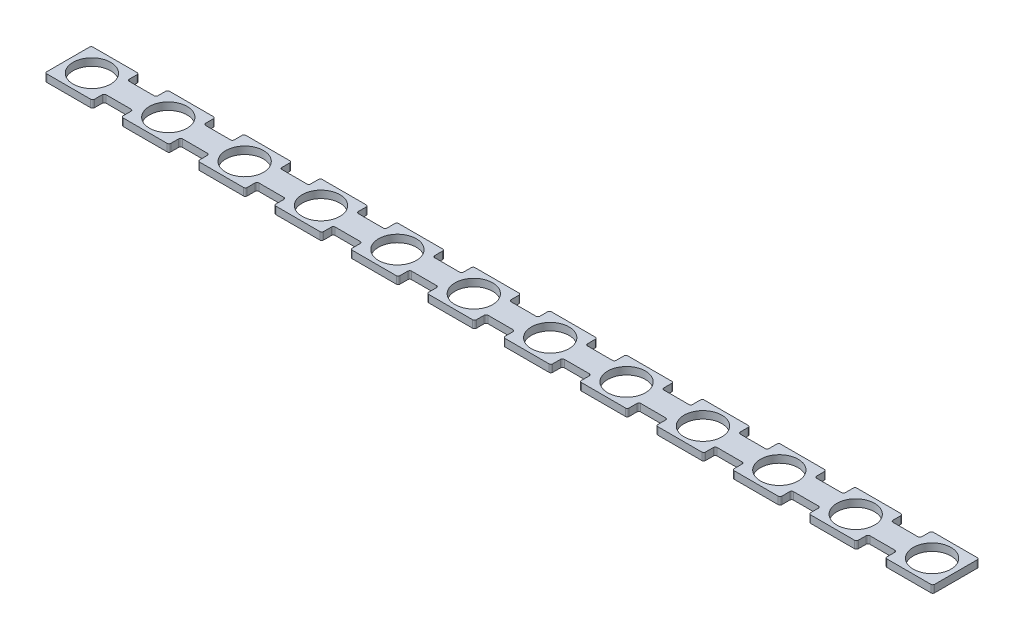
from build123d import *

# Parameters (mm, degrees)
BASE_DEPTH            = 0.4
NOTCH_DEPTH           = 49.021791928
HOLES_R               = 2.036544151
HOLE_DEPTH            = 49.021791928
HOLELP_COUNT          = 12
HOLELP_PITCH          = 8.25
NOTCHLP_COUNT         = 11
NOTCHLP_PITCH         = 8.25
NOTCHLP_COPY_1_DEPTH  = 49.021791928
NOTCHLP_COPY_2_DEPTH  = 49.021791928
NOTCHLP_COPY_3_DEPTH  = 49.021791928
NOTCHLP_COPY_4_DEPTH  = 49.021791928
NOTCHLP_COPY_5_DEPTH  = 49.021791928
NOTCHLP_COPY_6_DEPTH  = 49.021791928
NOTCHLP_COPY_7_DEPTH  = 49.021791928
NOTCHLP_COPY_8_DEPTH  = 49.021791928
NOTCHLP_COPY_9_DEPTH  = 49.021791928
NOTCHLP_COPY_10_DEPTH = 49.021791928


with BuildPart() as part:
    # BaseS → Base (new, symmetric)
    with BuildSketch(Plane(origin=(0, 0, 0), x_dir=(1, 0, 0), z_dir=(0, 1, 0))):
        with BuildLine():
            Line((-47.75, 2.5), (47.75, 2.5))
            ThreePointArc((47.75, 2.5), (47.891421356, 2.441421356), (47.95, 2.3))
            Line((47.95, 2.3), (47.95, -2.3))
            ThreePointArc((47.95, -2.3), (47.891421356, -2.441421356), (47.75, -2.5))
            Line((47.75, -2.5), (-47.75, -2.5))
            ThreePointArc((-47.75, -2.5), (-47.891421356, -2.441421356), (-47.95, -2.3))
            Line((-47.95, -2.3), (-47.95, 2.3))
            ThreePointArc((-47.95, 2.3), (-47.891421356, 2.441421356), (-47.75, 2.5))
        make_face()
    extrude(amount=BASE_DEPTH, both=True)

    # NotchS → Notch (cut, through all)
    with BuildSketch(Plane(origin=(0, 0.4, 0), x_dir=(1, 0, 0), z_dir=(0, 1, 0))):
        with BuildLine():
            Line((-42.6, 1.25), (-39.9, 1.25))
            ThreePointArc((-39.9, 1.25), (-39.758578644, 1.308578644), (-39.7, 1.45))
            Line((-39.7, 1.45), (-39.7, 2.299815366))
            ThreePointArc((-39.7, 2.299815366), (-39.641367278, 2.441367278), (-39.499815366, 2.5))
            Line((-39.499815366, 2.5), (-39.7, 2.5))
            Line((-39.7, 2.5), (-42.8, 2.5))
            Line((-42.8, 2.5), (-43.000184634, 2.5))
            ThreePointArc((-43.000184634, 2.5), (-42.858632722, 2.441367278), (-42.8, 2.299815366))
            Line((-42.8, 2.299815366), (-42.8, 1.45))
            ThreePointArc((-42.8, 1.45), (-42.741421356, 1.308578644), (-42.6, 1.25))
        make_face()
    notch = extrude(amount=-NOTCH_DEPTH, mode=Mode.SUBTRACT)

    # NotchVM: Notch across plane
    add(notch.mirror(Plane.XY), mode=Mode.SUBTRACT)

    # HoleS → Hole (cut, through all)
    with BuildSketch(Plane(origin=(0, 0.4, 0), x_dir=(1, 0, 0), z_dir=(0, 1, 0))):
        with Locations(Location((-45.375, 0, 0), (0, 0, 270))):
            Circle(HOLES_R)
    hole = extrude(amount=-HOLE_DEPTH, mode=Mode.SUBTRACT)

    # HoleLP: Hole ×12
    with Locations(*[(i * HOLELP_PITCH, 0, 0) for i in range(1, HOLELP_COUNT)]):
        add(hole, mode=Mode.SUBTRACT)

    # NotchLP: Notch ×11
    with Locations(*[(i * NOTCHLP_PITCH, 0, 0) for i in range(1, NOTCHLP_COUNT)]):
        add(notch, mode=Mode.SUBTRACT)

    # NotchLP copy 1 sketch → NotchLP copy 1 (cut, through all)
    with BuildSketch(Plane(origin=(8.25, 0.4, 0), x_dir=(1, 0, 0), z_dir=(0, 1, 0))):
        with BuildLine():
            Line((-42.6, -1.25), (-39.9, -1.25))
            ThreePointArc((-39.9, -1.25), (-39.758578644, -1.308578644), (-39.7, -1.45))
            Line((-39.7, -1.45), (-39.7, -2.299815366))
            ThreePointArc((-39.7, -2.299815366), (-39.641367278, -2.441367278), (-39.499815366, -2.5))
            Line((-39.499815366, -2.5), (-39.7, -2.5))
            Line((-39.7, -2.5), (-42.8, -2.5))
            Line((-42.8, -2.5), (-43.000184634, -2.5))
            ThreePointArc((-43.000184634, -2.5), (-42.858632722, -2.441367278), (-42.8, -2.299815366))
            Line((-42.8, -2.299815366), (-42.8, -1.45))
            ThreePointArc((-42.8, -1.45), (-42.741421356, -1.308578644), (-42.6, -1.25))
        make_face()
    extrude(amount=-NOTCHLP_COPY_1_DEPTH, mode=Mode.SUBTRACT)

    # NotchLP copy 2 sketch → NotchLP copy 2 (cut, through all)
    with BuildSketch(Plane(origin=(16.5, 0.4, 0), x_dir=(1, 0, 0), z_dir=(0, 1, 0))):
        with BuildLine():
            Line((-42.6, -1.25), (-39.9, -1.25))
            ThreePointArc((-39.9, -1.25), (-39.758578644, -1.308578644), (-39.7, -1.45))
            Line((-39.7, -1.45), (-39.7, -2.299815366))
            ThreePointArc((-39.7, -2.299815366), (-39.641367278, -2.441367278), (-39.499815366, -2.5))
            Line((-39.499815366, -2.5), (-39.7, -2.5))
            Line((-39.7, -2.5), (-42.8, -2.5))
            Line((-42.8, -2.5), (-43.000184634, -2.5))
            ThreePointArc((-43.000184634, -2.5), (-42.858632722, -2.441367278), (-42.8, -2.299815366))
            Line((-42.8, -2.299815366), (-42.8, -1.45))
            ThreePointArc((-42.8, -1.45), (-42.741421356, -1.308578644), (-42.6, -1.25))
        make_face()
    extrude(amount=-NOTCHLP_COPY_2_DEPTH, mode=Mode.SUBTRACT)

    # NotchLP copy 3 sketch → NotchLP copy 3 (cut, through all)
    with BuildSketch(Plane(origin=(24.75, 0.4, 0), x_dir=(1, 0, 0), z_dir=(0, 1, 0))):
        with BuildLine():
            Line((-42.6, -1.25), (-39.9, -1.25))
            ThreePointArc((-39.9, -1.25), (-39.758578644, -1.308578644), (-39.7, -1.45))
            Line((-39.7, -1.45), (-39.7, -2.299815366))
            ThreePointArc((-39.7, -2.299815366), (-39.641367278, -2.441367278), (-39.499815366, -2.5))
            Line((-39.499815366, -2.5), (-39.7, -2.5))
            Line((-39.7, -2.5), (-42.8, -2.5))
            Line((-42.8, -2.5), (-43.000184634, -2.5))
            ThreePointArc((-43.000184634, -2.5), (-42.858632722, -2.441367278), (-42.8, -2.299815366))
            Line((-42.8, -2.299815366), (-42.8, -1.45))
            ThreePointArc((-42.8, -1.45), (-42.741421356, -1.308578644), (-42.6, -1.25))
        make_face()
    extrude(amount=-NOTCHLP_COPY_3_DEPTH, mode=Mode.SUBTRACT)

    # NotchLP copy 4 sketch → NotchLP copy 4 (cut, through all)
    with BuildSketch(Plane(origin=(33, 0.4, 0), x_dir=(1, 0, 0), z_dir=(0, 1, 0))):
        with BuildLine():
            Line((-42.6, -1.25), (-39.9, -1.25))
            ThreePointArc((-39.9, -1.25), (-39.758578644, -1.308578644), (-39.7, -1.45))
            Line((-39.7, -1.45), (-39.7, -2.299815366))
            ThreePointArc((-39.7, -2.299815366), (-39.641367278, -2.441367278), (-39.499815366, -2.5))
            Line((-39.499815366, -2.5), (-39.7, -2.5))
            Line((-39.7, -2.5), (-42.8, -2.5))
            Line((-42.8, -2.5), (-43.000184634, -2.5))
            ThreePointArc((-43.000184634, -2.5), (-42.858632722, -2.441367278), (-42.8, -2.299815366))
            Line((-42.8, -2.299815366), (-42.8, -1.45))
            ThreePointArc((-42.8, -1.45), (-42.741421356, -1.308578644), (-42.6, -1.25))
        make_face()
    extrude(amount=-NOTCHLP_COPY_4_DEPTH, mode=Mode.SUBTRACT)

    # NotchLP copy 5 sketch → NotchLP copy 5 (cut, through all)
    with BuildSketch(Plane(origin=(41.25, 0.4, 0), x_dir=(1, 0, 0), z_dir=(0, 1, 0))):
        with BuildLine():
            Line((-42.6, -1.25), (-39.9, -1.25))
            ThreePointArc((-39.9, -1.25), (-39.758578644, -1.308578644), (-39.7, -1.45))
            Line((-39.7, -1.45), (-39.7, -2.299815366))
            ThreePointArc((-39.7, -2.299815366), (-39.641367278, -2.441367278), (-39.499815366, -2.5))
            Line((-39.499815366, -2.5), (-39.7, -2.5))
            Line((-39.7, -2.5), (-42.8, -2.5))
            Line((-42.8, -2.5), (-43.000184634, -2.5))
            ThreePointArc((-43.000184634, -2.5), (-42.858632722, -2.441367278), (-42.8, -2.299815366))
            Line((-42.8, -2.299815366), (-42.8, -1.45))
            ThreePointArc((-42.8, -1.45), (-42.741421356, -1.308578644), (-42.6, -1.25))
        make_face()
    extrude(amount=-NOTCHLP_COPY_5_DEPTH, mode=Mode.SUBTRACT)

    # NotchLP copy 6 sketch → NotchLP copy 6 (cut, through all)
    with BuildSketch(Plane(origin=(49.5, 0.4, 0), x_dir=(1, 0, 0), z_dir=(0, 1, 0))):
        with BuildLine():
            Line((-42.6, -1.25), (-39.9, -1.25))
            ThreePointArc((-39.9, -1.25), (-39.758578644, -1.308578644), (-39.7, -1.45))
            Line((-39.7, -1.45), (-39.7, -2.299815366))
            ThreePointArc((-39.7, -2.299815366), (-39.641367278, -2.441367278), (-39.499815366, -2.5))
            Line((-39.499815366, -2.5), (-39.7, -2.5))
            Line((-39.7, -2.5), (-42.8, -2.5))
            Line((-42.8, -2.5), (-43.000184634, -2.5))
            ThreePointArc((-43.000184634, -2.5), (-42.858632722, -2.441367278), (-42.8, -2.299815366))
            Line((-42.8, -2.299815366), (-42.8, -1.45))
            ThreePointArc((-42.8, -1.45), (-42.741421356, -1.308578644), (-42.6, -1.25))
        make_face()
    extrude(amount=-NOTCHLP_COPY_6_DEPTH, mode=Mode.SUBTRACT)

    # NotchLP copy 7 sketch → NotchLP copy 7 (cut, through all)
    with BuildSketch(Plane(origin=(57.75, 0.4, 0), x_dir=(1, 0, 0), z_dir=(0, 1, 0))):
        with BuildLine():
            Line((-42.6, -1.25), (-39.9, -1.25))
            ThreePointArc((-39.9, -1.25), (-39.758578644, -1.308578644), (-39.7, -1.45))
            Line((-39.7, -1.45), (-39.7, -2.299815366))
            ThreePointArc((-39.7, -2.299815366), (-39.641367278, -2.441367278), (-39.499815366, -2.5))
            Line((-39.499815366, -2.5), (-39.7, -2.5))
            Line((-39.7, -2.5), (-42.8, -2.5))
            Line((-42.8, -2.5), (-43.000184634, -2.5))
            ThreePointArc((-43.000184634, -2.5), (-42.858632722, -2.441367278), (-42.8, -2.299815366))
            Line((-42.8, -2.299815366), (-42.8, -1.45))
            ThreePointArc((-42.8, -1.45), (-42.741421356, -1.308578644), (-42.6, -1.25))
        make_face()
    extrude(amount=-NOTCHLP_COPY_7_DEPTH, mode=Mode.SUBTRACT)

    # NotchLP copy 8 sketch → NotchLP copy 8 (cut, through all)
    with BuildSketch(Plane(origin=(66, 0.4, 0), x_dir=(1, 0, 0), z_dir=(0, 1, 0))):
        with BuildLine():
            Line((-42.6, -1.25), (-39.9, -1.25))
            ThreePointArc((-39.9, -1.25), (-39.758578644, -1.308578644), (-39.7, -1.45))
            Line((-39.7, -1.45), (-39.7, -2.299815366))
            ThreePointArc((-39.7, -2.299815366), (-39.641367278, -2.441367278), (-39.499815366, -2.5))
            Line((-39.499815366, -2.5), (-39.7, -2.5))
            Line((-39.7, -2.5), (-42.8, -2.5))
            Line((-42.8, -2.5), (-43.000184634, -2.5))
            ThreePointArc((-43.000184634, -2.5), (-42.858632722, -2.441367278), (-42.8, -2.299815366))
            Line((-42.8, -2.299815366), (-42.8, -1.45))
            ThreePointArc((-42.8, -1.45), (-42.741421356, -1.308578644), (-42.6, -1.25))
        make_face()
    extrude(amount=-NOTCHLP_COPY_8_DEPTH, mode=Mode.SUBTRACT)

    # NotchLP copy 9 sketch → NotchLP copy 9 (cut, through all)
    with BuildSketch(Plane(origin=(74.25, 0.4, 0), x_dir=(1, 0, 0), z_dir=(0, 1, 0))):
        with BuildLine():
            Line((-42.6, -1.25), (-39.9, -1.25))
            ThreePointArc((-39.9, -1.25), (-39.758578644, -1.308578644), (-39.7, -1.45))
            Line((-39.7, -1.45), (-39.7, -2.299815366))
            ThreePointArc((-39.7, -2.299815366), (-39.641367278, -2.441367278), (-39.499815366, -2.5))
            Line((-39.499815366, -2.5), (-39.7, -2.5))
            Line((-39.7, -2.5), (-42.8, -2.5))
            Line((-42.8, -2.5), (-43.000184634, -2.5))
            ThreePointArc((-43.000184634, -2.5), (-42.858632722, -2.441367278), (-42.8, -2.299815366))
            Line((-42.8, -2.299815366), (-42.8, -1.45))
            ThreePointArc((-42.8, -1.45), (-42.741421356, -1.308578644), (-42.6, -1.25))
        make_face()
    extrude(amount=-NOTCHLP_COPY_9_DEPTH, mode=Mode.SUBTRACT)

    # NotchLP copy 10 sketch → NotchLP copy 10 (cut, through all)
    with BuildSketch(Plane(origin=(82.5, 0.4, 0), x_dir=(1, 0, 0), z_dir=(0, 1, 0))):
        with BuildLine():
            Line((-42.6, -1.25), (-39.9, -1.25))
            ThreePointArc((-39.9, -1.25), (-39.758578644, -1.308578644), (-39.7, -1.45))
            Line((-39.7, -1.45), (-39.7, -2.299815366))
            ThreePointArc((-39.7, -2.299815366), (-39.641367278, -2.441367278), (-39.499815366, -2.5))
            Line((-39.499815366, -2.5), (-39.7, -2.5))
            Line((-39.7, -2.5), (-42.8, -2.5))
            Line((-42.8, -2.5), (-43.000184634, -2.5))
            ThreePointArc((-43.000184634, -2.5), (-42.858632722, -2.441367278), (-42.8, -2.299815366))
            Line((-42.8, -2.299815366), (-42.8, -1.45))
            ThreePointArc((-42.8, -1.45), (-42.741421356, -1.308578644), (-42.6, -1.25))
        make_face()
    extrude(amount=-NOTCHLP_COPY_10_DEPTH, mode=Mode.SUBTRACT)


solid = part.part
